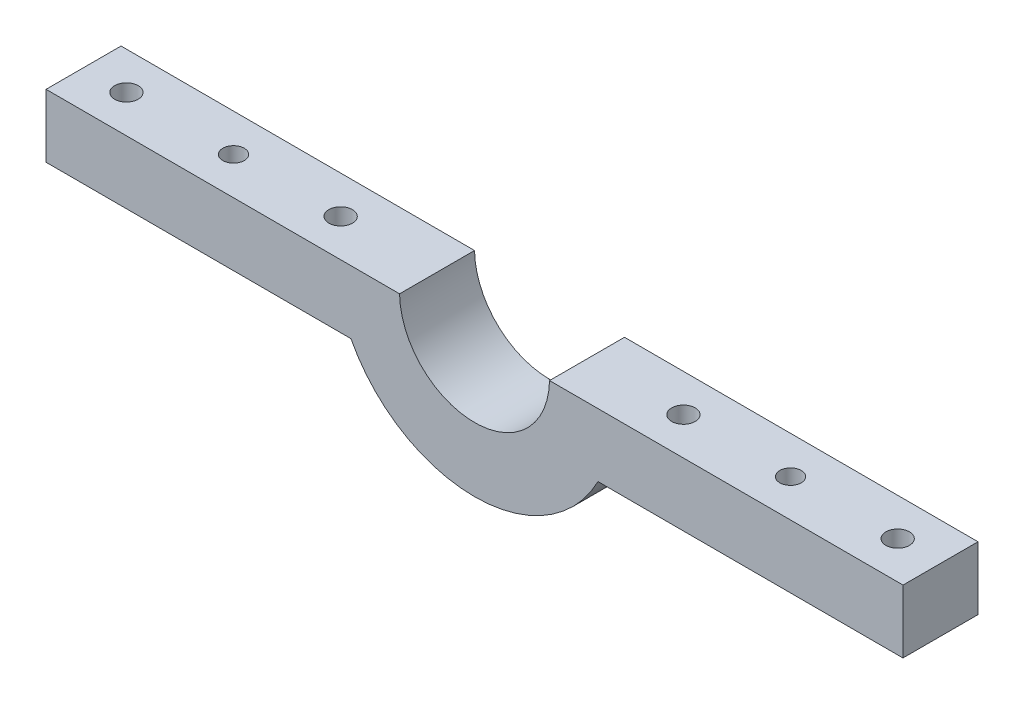
from build123d import *

# Parameters (mm, degrees)
RESSALTO_EXTRUS_O1_DEPTH         = 35
FURO_DE_DI_METRO_11_0_11_1_D     = 11
FUROS_GUIA_COM_10_0MM1_D         = 10
FURO_DE_DI_METRO_11_0_11_2_D     = 11
FURO_DE_DI_METRO_11_0_11_2_DEPTH = 10
FURO_DE_DI_METRO_11_0_11_2_TIP   = 3.304733405
ESBO_O8_W                        = 0.2
ESBO_O8_H                        = 36.606458827
CORTE_EXTRUS_O1_DEPTH            = 0.2


with BuildPart() as part:
    # Esboço1 → Ressalto-extrusão1 (new body)
    with BuildSketch(Plane.XY):
        with BuildLine():
            Line((-199.997669575, -240.109131808), (-34.994179097, -240.27276126))
            ThreePointArc((-34.994179097, -240.27276126), (-0.031980607, -274.807449281), (34.998643265, -240.34217123))
            Line((34.998643265, -240.34217123), (200.002133743, -240.505800682))
            Line((200.002133743, -240.505800682), (199.972879413, -270.005786177))
            Line((199.972879413, -270.005786177), (57.635762375, -269.864634348))
            ThreePointArc((57.635762375, -269.864634348), (-0.061730772, -304.80743453), (-57.689806866, -269.750269132))
            Line((-57.689806866, -269.750269132), (-200.026923904, -269.609117302))
            Line((-200.026923904, -269.609117302), (-199.997669575, -240.109131808))
        make_face()
    extrude(amount=-RESSALTO_EXTRUS_O1_DEPTH)

    # Furo de diâmetro Ø11.0 (11)1 (through all)
    with Locations(Plane(origin=(-0.238306111, -240.30722771, 0), x_dir=(0.9999995082930158, -0.000991672187112085, 0), z_dir=(0.000991672187112085, 0.9999995082930158, 0))):
        with Locations((-179.759461687, 17.5), (-79.759461687, 17.5), (80.240538313, 17.5), (180.240538313, 17.5)):
            Hole(FURO_DE_DI_METRO_11_0_11_1_D / 2)

    # Furos-guia com Ø10.0mm1 (through all)
    with Locations(Plane(origin=(-0.267560441, -269.807213205, 0), x_dir=(-0.9999995082930158, 0.0009916721871120312, 0), z_dir=(-0.0009916721871120312, -0.9999995082930158, 0))):
        with Locations((129.759461687, 17.5), (-130.240538313, 17.5), (-221.181262437, -155.418379851)):
            Hole(FUROS_GUIA_COM_10_0MM1_D / 2)

    # Furo de diâmetro Ø11.0 (11)2
    with Locations(Plane(origin=(-0.267560441, -269.807213205, 0), x_dir=(-0.9999995082930158, 0.0009916721871120312, 0), z_dir=(-0.0009916721871120312, -0.9999995082930158, 0))):
        with Locations((129.759461687, 17.5), (-130.240538313, 17.5)):
            Hole(FURO_DE_DI_METRO_11_0_11_2_D / 2, depth=FURO_DE_DI_METRO_11_0_11_2_DEPTH)
            with Locations((0, 0, -(FURO_DE_DI_METRO_11_0_11_2_DEPTH + FURO_DE_DI_METRO_11_0_11_2_TIP / 2))):  # 118° drill point
                Cone(0, FURO_DE_DI_METRO_11_0_11_2_D / 2, FURO_DE_DI_METRO_11_0_11_2_TIP, mode=Mode.SUBTRACT)

    # Esboço8 → Corte-extrusão1 (cut)
    with BuildSketch(Plane(origin=(0, 0, -35), x_dir=(-1, 0, 0), z_dir=(0, 0, -1))):
        with Locations((-0.00272792, -289.800051975)):
            Rectangle(ESBO_O8_W, ESBO_O8_H)
    extrude(amount=-CORTE_EXTRUS_O1_DEPTH, mode=Mode.SUBTRACT)


solid = part.part
